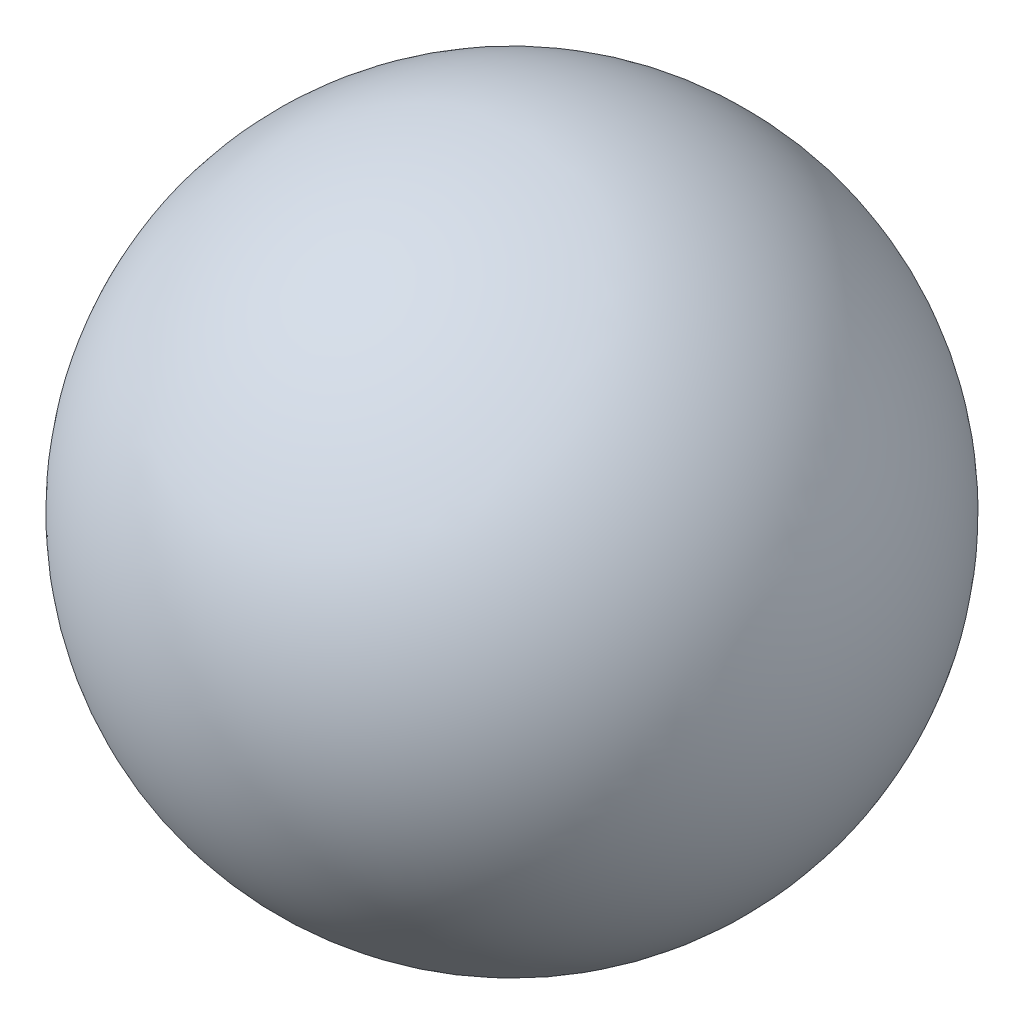
from build123d import *


with BuildPart() as part:
    # Esquisse1 → Base-Révolution (revolve)
    with BuildSketch(Plane.XY):
        with BuildLine():
            Line((-3.5, 0), (3.5, 0))
            ThreePointArc((3.5, 0), (0, 3.5), (-3.5, 0))
        make_face()
    revolve(axis=Axis((-4.415030823, 0, 0), (1, 0, 0)))


solid = part.part
